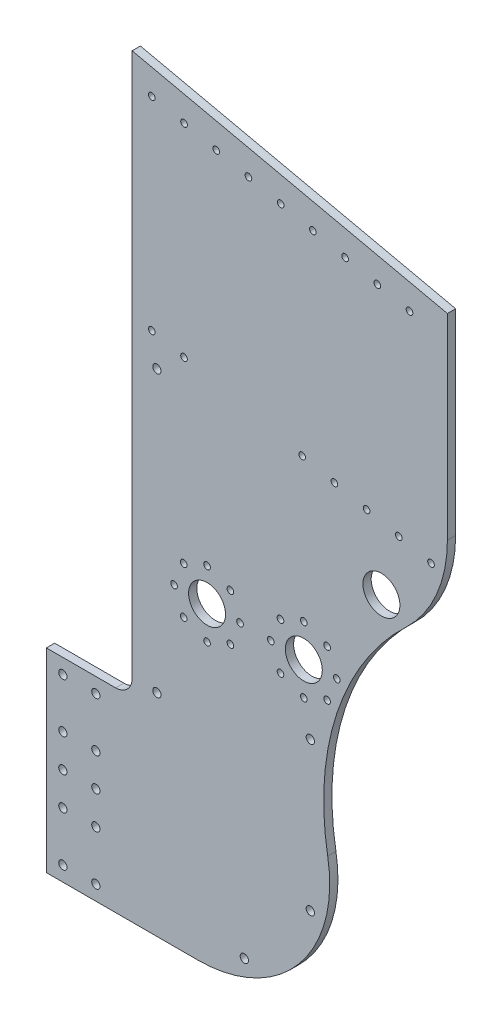
from build123d import *

# Parameters (mm, degrees)
SKETCH1_W                                          = 308.737
SKETCH1_H                                          = 580.9742
BOSS_EXTRUDE1_STOCK_DEPTH                          = 6.35
CUT_EXTRUDE1_MOUNTING_DEPTH                        = 658.943674439
CUT_EXTRUDE1_MOUNTING_DEPTH_BACK                   = 658.943674439
SKETCH2_R                                          = 3.175
CUT_EXTRUDE2_ELEVATOR_CLEARANCE_DEPTH              = 658.943674439
CUT_EXTRUDE2_ELEVATOR_CLEARANCE_DEPTH_BACK         = 658.943674439
SKETCH3_W                                          = 66.04
SKETCH3_H                                          = 431.1142
CUT_EXTRUDE3_SCORER_ANGLE_MATERIAL_REMO_DEPTH      = 658.943674439
CUT_EXTRUDE3_SCORER_ANGLE_MATERIAL_REMO_DEPTH_BACK = 658.943674439
CUT_EXTRUDE4_ALGAE_BEARING_HOLES_DEPTH             = 658.943674439
CUT_EXTRUDE4_ALGAE_BEARING_HOLES_DEPTH_BACK        = 658.943674439
SKETCH5_R                                          = 14.224
CUT_EXTRUDE5_MOTOR_MOUNTING_HOLES_DEPTH            = 658.943674439
CUT_EXTRUDE5_MOTOR_MOUNTING_HOLES_DEPTH_BACK       = 658.943674439
SKETCH6_R                                          = 2.5527
CUT_EXTRUDE6_ALGAE_FITMENT_DEPTH                   = 658.943674439
CUT_EXTRUDE6_ALGAE_FITMENT_DEPTH_BACK              = 658.943674439
SKETCH7_R                                          = 203.2
CUT_EXTRUDE7_TOP_BOTTOM_MOUNTING_DEPTH             = 658.943674439
CUT_EXTRUDE7_TOP_BOTTOM_MOUNTING_DEPTH_BACK        = 658.943674439
SKETCH8_R                                          = 2.5527
FILLET1_R                                          = 101.6
FILLET2_R                                          = 101.6
FILLET3_R                                          = 12.7
CUT_EXTRUDE1_DEPTH                                 = 658.943674439
CUT_EXTRUDE1_DEPTH_BACK                            = 658.943674439
SKETCH9_R                                          = 3.175
CUT_EXTRUDE2_DEPTH                                 = 658.943674439
CUT_EXTRUDE2_DEPTH_BACK                            = 658.943674439
SKETCH11_R                                         = 2.5527
CUT_EXTRUDE3_DEPTH                                 = 658.943674439
CUT_EXTRUDE3_DEPTH_BACK                            = 658.943674439
SKETCH12_R                                         = 2.5527


with BuildPart() as part:
    # Sketch1 → Boss-Extrude1 _Stock (new body)
    with BuildSketch(Plane.XY):
        with Locations((154.3685, 290.4871)):
            Rectangle(SKETCH1_W, SKETCH1_H)
    extrude(amount=BOSS_EXTRUDE1_STOCK_DEPTH)

    # Sketch2 → Cut-Extrude1 _Mounting (cut, two sides: drawn at the far end of the back side and taken through both)
    with BuildSketch(Plane.XY.offset(6.35).offset(-CUT_EXTRUDE1_MOUNTING_DEPTH_BACK)):
        with Locations((12.7, 11.43)):
            Circle(SKETCH2_R)
        with Locations((12.7, 49.53)):
            Circle(SKETCH2_R)
        with Locations((12.7, 74.93)):
            Circle(SKETCH2_R)
        with Locations((12.7, 100.33)):
            Circle(SKETCH2_R)
        with Locations((12.7, 138.43)):
            Circle(SKETCH2_R)
        with Locations(Location((38.1, 11.43, 0), (0, 0, 180))):
            Circle(SKETCH2_R)
        with Locations(Location((38.1, 49.53, 0), (0, 0, 180))):
            Circle(SKETCH2_R)
        with Locations(Location((38.1, 74.93, 0), (0, 0, 180))):
            Circle(SKETCH2_R)
        with Locations(Location((38.1, 100.33, 0), (0, 0, 180))):
            Circle(SKETCH2_R)
        with Locations(Location((38.1, 138.43, 0), (0, 0, 180))):
            Circle(SKETCH2_R)
    extrude(amount=CUT_EXTRUDE1_MOUNTING_DEPTH + CUT_EXTRUDE1_MOUNTING_DEPTH_BACK, mode=Mode.SUBTRACT)

    # Sketch3 → Cut-Extrude2 _Elevator Clearance (cut, two sides: drawn at the far end of the back side and taken through both)
    with BuildSketch(Plane.XY.offset(6.35).offset(-CUT_EXTRUDE2_ELEVATOR_CLEARANCE_DEPTH_BACK)):
        with Locations((33.02, 365.4171)):
            Rectangle(SKETCH3_W, SKETCH3_H)
    extrude(amount=CUT_EXTRUDE2_ELEVATOR_CLEARANCE_DEPTH + CUT_EXTRUDE2_ELEVATOR_CLEARANCE_DEPTH_BACK, mode=Mode.SUBTRACT)

    # Sketch4 → Cut-Extrude3 _Scorer Angle Material Remo (cut, two sides: drawn at the far end of the back side and taken through both)
    with BuildSketch(Plane.XY.offset(6.35).offset(-CUT_EXTRUDE3_SCORER_ANGLE_MATERIAL_REMO_DEPTH_BACK)):
        Polygon((66.04, 580.9742), (308.737, 527.169570461), (308.737, 580.9742), align=None)
    extrude(amount=CUT_EXTRUDE3_SCORER_ANGLE_MATERIAL_REMO_DEPTH + CUT_EXTRUDE3_SCORER_ANGLE_MATERIAL_REMO_DEPTH_BACK, mode=Mode.SUBTRACT)

    # Sketch5 → Cut-Extrude4 _Algae Bearing Holes (cut, two sides: drawn at the far end of the back side and taken through both)
    with BuildSketch(Plane.XY.offset(6.35).offset(-CUT_EXTRUDE4_ALGAE_BEARING_HOLES_DEPTH_BACK)):
        with Locations((198.19747, 241.079274)):
            Circle(SKETCH5_R)
        with Locations((257.937, 314.325)):
            Circle(SKETCH5_R)
        with Locations((123.713603803, 241.079274)):
            Circle(SKETCH5_R)
    extrude(amount=CUT_EXTRUDE4_ALGAE_BEARING_HOLES_DEPTH + CUT_EXTRUDE4_ALGAE_BEARING_HOLES_DEPTH_BACK, mode=Mode.SUBTRACT)

    # Sketch6 → Cut-Extrude5 _Motor Mounting Holes (cut, two sides: drawn at the far end of the back side and taken through both)
    with BuildSketch(Plane.XY.offset(6.35).offset(-CUT_EXTRUDE5_MOTOR_MOUNTING_HOLES_DEPTH_BACK)):
        with Locations((216.157982242, 259.039786242)):
            Circle(SKETCH6_R)
        with Locations((180.236957758, 259.039786242)):
            Circle(SKETCH6_R)
        with Locations((180.236957758, 223.118761758)):
            Circle(SKETCH6_R)
        with Locations((216.157982242, 223.118761758)):
            Circle(SKETCH6_R)
        with Locations((141.674116045, 259.039786242)):
            Circle(SKETCH6_R)
        with Locations((141.674116045, 223.118761758)):
            Circle(SKETCH6_R)
        with Locations((105.753091561, 223.118761758)):
            Circle(SKETCH6_R)
        with Locations((105.753091561, 259.039786242)):
            Circle(SKETCH6_R)
    extrude(amount=CUT_EXTRUDE5_MOTOR_MOUNTING_HOLES_DEPTH + CUT_EXTRUDE5_MOTOR_MOUNTING_HOLES_DEPTH_BACK, mode=Mode.SUBTRACT)

    # Sketch7 → Cut-Extrude6 _Algae Fitment (cut, two sides: drawn at the far end of the back side and taken through both)
    with BuildSketch(Plane.XY.offset(6.35).offset(-CUT_EXTRUDE6_ALGAE_FITMENT_DEPTH_BACK)):
        with Locations((416.687, 154.686)):
            Circle(SKETCH7_R)
    extrude(amount=CUT_EXTRUDE6_ALGAE_FITMENT_DEPTH + CUT_EXTRUDE6_ALGAE_FITMENT_DEPTH_BACK, mode=Mode.SUBTRACT)

    # Sketch8 → Cut-Extrude7 _Top_Bottom Mounting (cut, two sides: drawn at the far end of the back side and taken through both)
    with BuildSketch(Plane.XY.offset(6.35).offset(-CUT_EXTRUDE7_TOP_BOTTOM_MOUNTING_DEPTH_BACK)):
        with Locations((81.187742374, 558.103501617)):
            Circle(SKETCH8_R)
        with Locations((105.985660955, 396.505737337)):
            Circle(SKETCH8_R)
        with Locations((81.187742374, 402.003303531)):
            Circle(SKETCH8_R)
        with Locations((196.937583324, 376.342181591)):
            Circle(SKETCH8_R)
        with Locations((221.735501905, 370.844615397)):
            Circle(SKETCH8_R)
        with Locations((246.533420485, 365.347049203)):
            Circle(SKETCH8_R)
        with Locations((271.331339066, 359.849483008)):
            Circle(SKETCH8_R)
        with Locations((296.129257647, 354.351916814)):
            Circle(SKETCH8_R)
        with Locations((105.985660955, 552.605935423)):
            Circle(SKETCH8_R)
        with Locations((130.783579536, 547.108369229)):
            Circle(SKETCH8_R)
        with Locations((155.581498117, 541.610803035)):
            Circle(SKETCH8_R)
        with Locations((180.379416697, 536.113236841)):
            Circle(SKETCH8_R)
        with Locations((205.177335278, 530.615670647)):
            Circle(SKETCH8_R)
        with Locations((229.975253859, 525.118104453)):
            Circle(SKETCH8_R)
        with Locations((254.77317244, 519.620538259)):
            Circle(SKETCH8_R)
        with Locations((279.571091021, 514.122972065)):
            Circle(SKETCH8_R)
    extrude(amount=CUT_EXTRUDE7_TOP_BOTTOM_MOUNTING_DEPTH + CUT_EXTRUDE7_TOP_BOTTOM_MOUNTING_DEPTH_BACK, mode=Mode.SUBTRACT)

    # Fillet1
    fillet1_edges = [part.edges().sort_by_distance(p)[0] for p in [
        (308.737, 326.840109739, 3.175),
    ]]
    fillet(fillet1_edges, radius=FILLET1_R)

    # Fillet2
    fillet2_edges = [part.edges().sort_by_distance(p)[0] for p in [
        (284.920231033, 0, 3.175),
    ]]
    fillet(fillet2_edges, radius=FILLET2_R)

    # Fillet3
    fillet3_edges = [part.edges().sort_by_distance(p)[0] for p in [
        (66.04, 149.86, 3.175),
    ]]
    fillet(fillet3_edges, radius=FILLET3_R)

    # Sketch9 → Cut-Extrude1 (cut, two sides: drawn at the far end of the back side and taken through both)
    with BuildSketch(Plane.XY.offset(6.35).offset(-CUT_EXTRUDE1_DEPTH_BACK)):
        with Locations((85.09, 162.56)):
            Circle(SKETCH9_R)
        with Locations((152.4, 19.05)):
            Circle(SKETCH9_R)
        with Locations((203.2, 76.2)):
            Circle(SKETCH9_R)
        with Locations((85.09, 378.46)):
            Circle(SKETCH9_R)
        with Locations((203.2, 190.5)):
            Circle(SKETCH9_R)
    extrude(amount=CUT_EXTRUDE1_DEPTH + CUT_EXTRUDE1_DEPTH_BACK, mode=Mode.SUBTRACT)

    # Sketch11 → Cut-Extrude2 (cut, two sides: drawn at the far end of the back side and taken through both)
    with BuildSketch(Plane.XY.offset(6.35).offset(-CUT_EXTRUDE2_DEPTH_BACK)):
        with Locations((198.197424758, 266.479274)):
            Circle(SKETCH11_R)
        with Locations((223.59747, 241.079319242)):
            Circle(SKETCH11_R)
        with Locations((172.79747, 241.079319242)):
            Circle(SKETCH11_R)
        with Locations((198.197424758, 215.679274)):
            Circle(SKETCH11_R)
    extrude(amount=CUT_EXTRUDE2_DEPTH + CUT_EXTRUDE2_DEPTH_BACK, mode=Mode.SUBTRACT)

    # Sketch12 → Cut-Extrude3 (cut, two sides: drawn at the far end of the back side and taken through both)
    with BuildSketch(Plane.XY.offset(6.35).offset(-CUT_EXTRUDE3_DEPTH_BACK)):
        with Locations((123.713558561, 266.479274)):
            Circle(SKETCH12_R)
        with Locations((149.113603803, 241.079319242)):
            Circle(SKETCH12_R)
        with Locations((123.713649045, 215.679274)):
            Circle(SKETCH12_R)
        with Locations((98.313603803, 241.079228758)):
            Circle(SKETCH12_R)
    extrude(amount=CUT_EXTRUDE3_DEPTH + CUT_EXTRUDE3_DEPTH_BACK, mode=Mode.SUBTRACT)


solid = part.part
